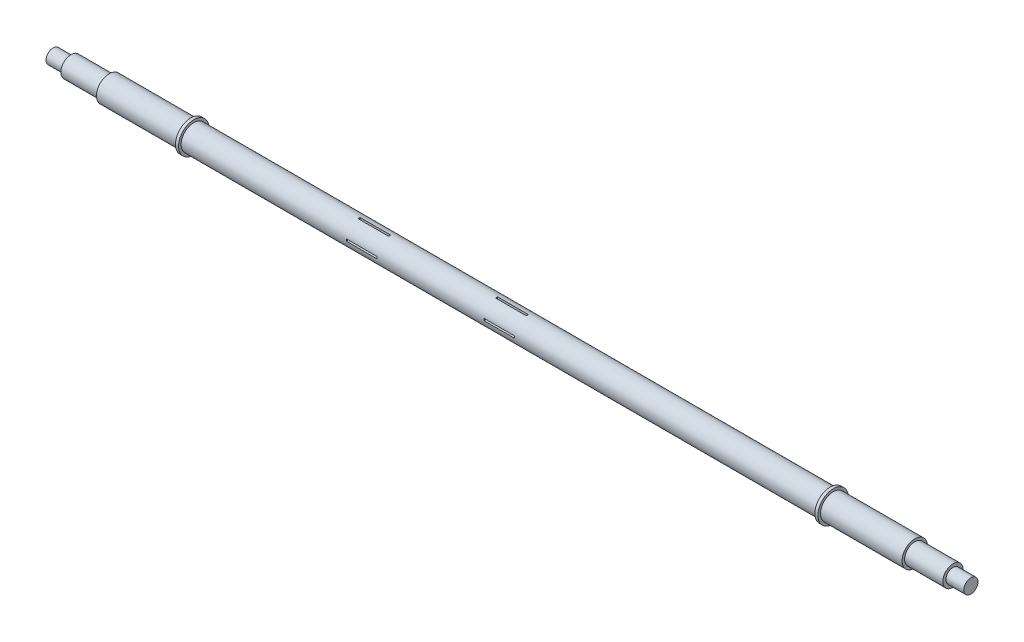
from build123d import *

# Parameters (mm, degrees)
Y_KSEKLIK_EKSTR_ZYON1_START = -315
IZIM2_R                     = 15
Y_KSEKLIK_EKSTR_ZYON1_DEPTH = 3
Y_KSEKLIK_EKSTR_ZYON2_START = 312
IZIM2_2_R                   = 15
Y_KSEKLIK_EKSTR_ZYON2_DEPTH = 3
KES_EKSTR_ZYON2_DEPTH       = 15
KES_EKSTR_ZYON3_START       = -600
KES_EKSTR_ZYON3_DEPTH       = 30


with BuildPart() as part:
    # Çizim1 → Döndür1 (revolve)
    with BuildSketch(Plane.XY):
        Polygon((450, 0), (450, 7), (432.5, 7), (432.5, 10), (395, 10), (395, 12.5), (-395, 12.5), (-395, 10), (-432.5, 10), (-432.5, 7), (-450, 7), (-450, 0), align=None)
    revolve(axis=Axis((-450, 0, 0), (1, 0, 0)))

    # Çizim2 → Yükseklik-Ekstrüzyon1 (add)
    with BuildSketch(Plane(origin=(0, 0, 0), x_dir=(0, 0, -1), z_dir=(1, 0, 0)).offset(Y_KSEKLIK_EKSTR_ZYON1_START)):
        Circle(IZIM2_R)
    extrude(amount=Y_KSEKLIK_EKSTR_ZYON1_DEPTH)

    # Çizim2<2> → Yükseklik-Ekstrüzyon2 (add)
    with BuildSketch(Plane(origin=(0, 0, 0), x_dir=(0, 0, -1), z_dir=(1, 0, 0)).offset(Y_KSEKLIK_EKSTR_ZYON2_START)):
        Circle(IZIM2_2_R)
    extrude(amount=Y_KSEKLIK_EKSTR_ZYON2_DEPTH)

    # Çizim4 → Kes-Ekstrüzyon2 (cut, symmetric)
    with BuildSketch(Plane(origin=(0, 0, 0), x_dir=(0, 0, -1), z_dir=(1, 0, 0))):
        with BuildLine():
            Line((-12.459935794, 1), (-1, 1))
            Line((-1, 1), (-1, 12.459935794))
            ThreePointArc((-1, 12.459935794), (0, 12.5), (1, 12.459935794))
            Line((1, 12.459935794), (1, 1))
            Line((1, 1), (12.459935794, 1))
            ThreePointArc((12.459935794, 1), (12.5, 0), (12.459935794, -1))
            Line((12.459935794, -1), (1, -1))
            Line((1, -1), (1, -12.459935794))
            ThreePointArc((1, -12.459935794), (0, -12.5), (-1, -12.459935794))
            Line((-1, -12.459935794), (-1, -1))
            Line((-1, -1), (-12.459935794, -1))
            ThreePointArc((-12.459935794, -1), (-12.5, 0), (-12.459935794, 1))
        make_face()
    extrude(amount=KES_EKSTR_ZYON2_DEPTH, both=True, mode=Mode.SUBTRACT)

    # Çizim6 → Kes-Ekstrüzyon3 (cut)
    with BuildSketch(Plane(origin=(450, 0, 0), x_dir=(0, 0, -1), z_dir=(1, 0, 0)).offset(KES_EKSTR_ZYON3_START)):
        with BuildLine():
            Line((1, 1), (1, 12.459935794))
            ThreePointArc((1, 12.459935794), (0, 12.5), (-1, 12.459935794))
            Line((-1, 12.459935794), (-1, 1))
            Line((-1, 1), (-12.459935794, 1))
            ThreePointArc((-12.459935794, 1), (-12.5, 0), (-12.459935794, -1))
            Line((-12.459935794, -1), (-1, -1))
            Line((-1, -1), (-1, -12.459935794))
            ThreePointArc((-1, -12.459935794), (0, -12.5), (1, -12.459935794))
            Line((1, -12.459935794), (1, -1))
            Line((1, -1), (12.459935794, -1))
            ThreePointArc((12.459935794, -1), (12.5, 0), (12.459935794, 1))
            Line((12.459935794, 1), (1, 1))
        make_face()
    extrude(amount=KES_EKSTR_ZYON3_DEPTH, mode=Mode.SUBTRACT)


solid = part.part
